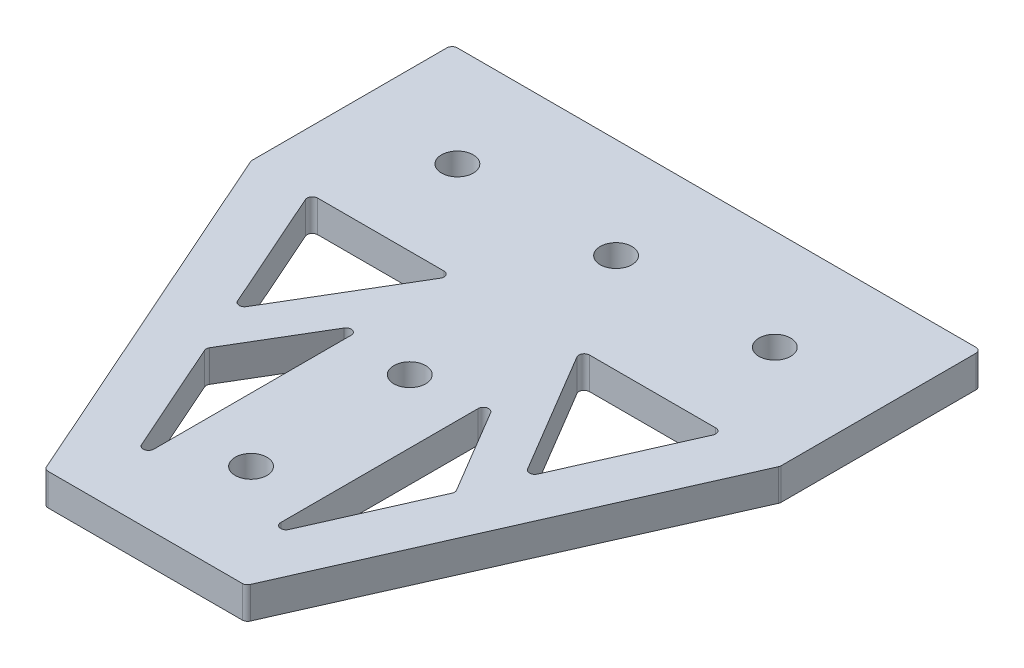
from build123d import *

# Parameters (mm, degrees)
SKETCH1_R           = 1.5
BOSS_EXTRUDE2_DEPTH = 3
FILLET1_R           = 0.5
CUT_EXTRUDE1_DEPTH  = 3


with BuildPart() as part:
    # Sketch1 → Boss-Extrude2 (new body)
    with BuildSketch(Plane(origin=(0, 0, 0), x_dir=(1, 0, 0), z_dir=(0, 1, 0))):
        Polygon((15.5, -54), (34.5, -54), (50, -19), (50, 0), (0, 0), (0, -19), align=None)
        with Locations(Location((10, -9.5, 0), (0, 0, 270))):
            Circle(SKETCH1_R, mode=Mode.SUBTRACT)
        with Locations(Location((40, -9.5, 0), (0, 0, 270))):
            Circle(SKETCH1_R, mode=Mode.SUBTRACT)
        with Locations(Location((25, -44, 0), (0, 0, 270))):
            Circle(SKETCH1_R, mode=Mode.SUBTRACT)
        with Locations(Location((25, -29, 0), (0, 0, 270))):
            Circle(SKETCH1_R, mode=Mode.SUBTRACT)
        with Locations(Location((25, -9.5, 0), (0, 0, 270))):
            Circle(SKETCH1_R, mode=Mode.SUBTRACT)
    extrude(amount=BOSS_EXTRUDE2_DEPTH)

    # Fillet1
    fillet1_edges = [part.edges().sort_by_distance(p)[0] for p in [
        (50, 1.5, 0),
        (50, 1.5, 19),
        (34.5, 1.5, 54),
        (15.5, 1.5, 54),
        (0, 1.5, 19),
        (0, 1.5, 0),
    ]]
    fillet(fillet1_edges, radius=FILLET1_R)

    # Sketch2 → Cut-Extrude1 (cut)
    with BuildSketch(Plane(origin=(0, 3, 0), x_dir=(1, 0, 0), z_dir=(0, 1, 0))):
        with BuildLine():
            Line((6.189797727, -18.894239223), (18.120962557, -18.894239223))
            ThreePointArc((18.120962557, -18.894239223), (18.555574645, -19.147030136), (18.550722787, -19.649789891))
            Line((18.550722787, -19.649789891), (11.712415101, -31.149789891))
            ThreePointArc((11.712415101, -31.149789891), (11.25278078, -31.393345964), (10.825480175, -31.096702302))
            Line((10.825480175, -31.096702302), (5.732623032, -19.596702302))
            ThreePointArc((5.732623032, -19.596702302), (5.770732375, -19.121504498), (6.189797727, -18.894239223))
        make_face()
        with BuildLine():
            Line((18.070239769, -28.284056063), (13.335984482, -36.245665617))
            ThreePointArc((13.335984482, -36.245665617), (13.266637971, -36.471342196), (13.308570017, -36.703679365))
            Line((13.308570017, -36.703679365), (18.042825305, -47.39393324))
            ThreePointArc((18.042825305, -47.39393324), (18.603471379, -47.680646687), (19, -47.191470161))
            Line((19, -47.191470161), (19, -28.539606732))
            ThreePointArc((19, -28.539606732), (18.632513933, -28.057486355), (18.070239769, -28.284056063))
        make_face()
        with BuildLine():
            Line((38.287584899, -31.149789891), (31.449277213, -19.649789891))
            ThreePointArc((31.449277213, -19.649789891), (31.444425355, -19.147030136), (31.879037443, -18.894239223))
            Line((31.879037443, -18.894239223), (43.810202273, -18.894239223))
            ThreePointArc((43.810202273, -18.894239223), (44.229267625, -19.121504498), (44.267376968, -19.596702302))
            Line((44.267376968, -19.596702302), (39.174519825, -31.096702302))
            ThreePointArc((39.174519825, -31.096702302), (38.74721922, -31.393345964), (38.287584899, -31.149789891))
        make_face()
        with BuildLine():
            Line((31, -47.191470161), (31, -28.539606732))
            ThreePointArc((31, -28.539606732), (31.367486067, -28.057486355), (31.929760231, -28.284056063))
            Line((31.929760231, -28.284056063), (36.664015518, -36.245665617))
            ThreePointArc((36.664015518, -36.245665617), (36.733362029, -36.471342196), (36.691429983, -36.703679365))
            Line((36.691429983, -36.703679365), (31.957174695, -47.39393324))
            ThreePointArc((31.957174695, -47.39393324), (31.396528621, -47.680646687), (31, -47.191470161))
        make_face()
    extrude(amount=-CUT_EXTRUDE1_DEPTH, mode=Mode.SUBTRACT)


solid = part.part
